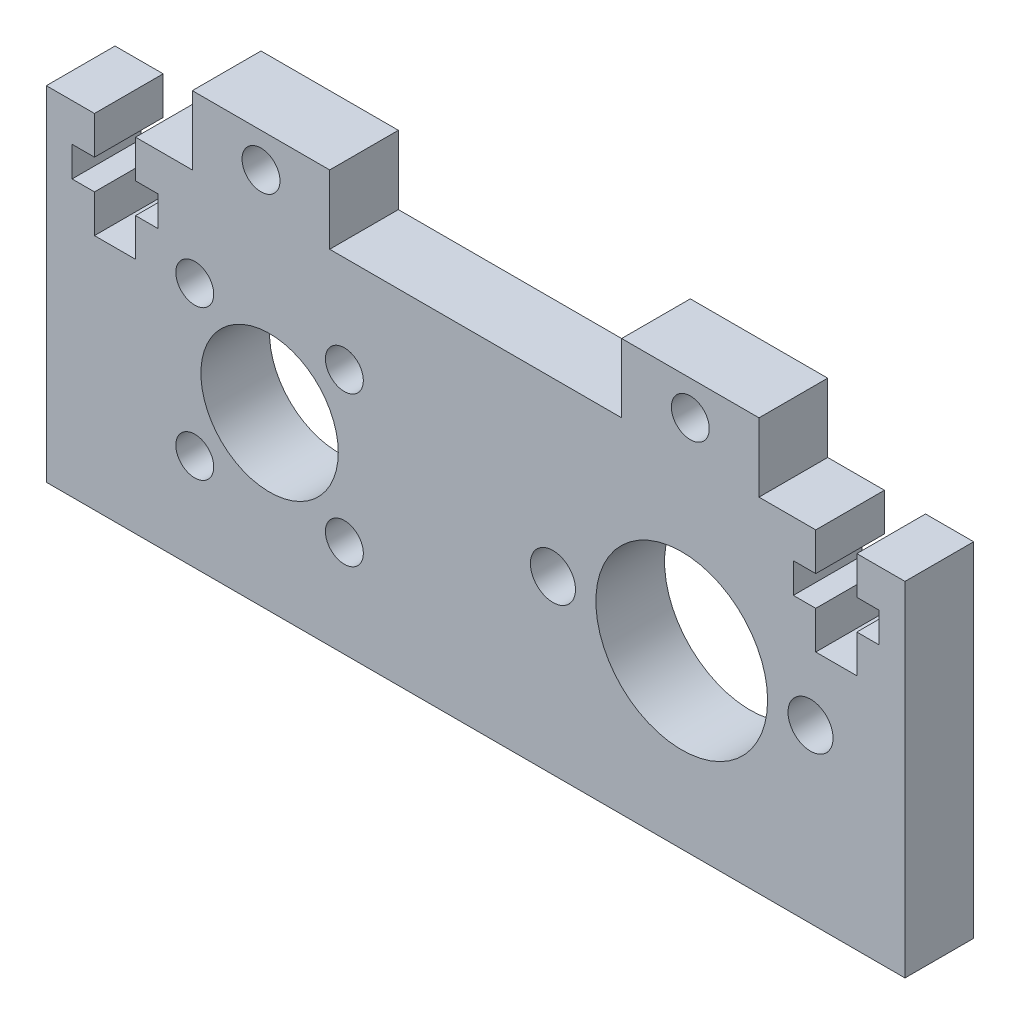
from build123d import *

# Parameters (mm, degrees)
SKETCH1_W           = 39.6875
SKETCH1_H           = 31.75
BOSS_EXTRUDE1_DEPTH = 6.35
SKETCH2_R           = 6.35
SKETCH2_R_2         = 1.7526
CUT_EXTRUDE1_DEPTH  = 6.35
CUT_EXTRUDE4_DEPTH  = 6.35
SKETCH4_W           = 12.7
SKETCH4_H           = 6.35
SKETCH4_R           = 1.7526
BOSS_EXTRUDE2_DEPTH = 6.35
SKETCH5_R           = 7.9375
SKETCH5_R_2         = 2.0828
CUT_EXTRUDE3_DEPTH  = 6.35


with BuildPart() as part:
    # Sketch1 → Boss-Extrude1 (new body)
    with BuildSketch(Plane.XY):
        with Locations((-19.84375, 0)):
            Rectangle(SKETCH1_W, SKETCH1_H)
    boss_extrude1 = extrude(amount=BOSS_EXTRUDE1_DEPTH)

    # Sketch2 → Cut-Extrude1 (cut)
    with BuildSketch(Plane.XY.offset(6.35)):
        with Locations((-19.05, 0)):
            Circle(SKETCH2_R)
        with Locations((-25.964797213, 6.914797213)):
            Circle(SKETCH2_R_2)
        with Locations((-12.135202787, 6.914797213)):
            Circle(SKETCH2_R_2)
        with Locations((-12.135202787, -6.914797213)):
            Circle(SKETCH2_R_2)
        with Locations((-25.964797213, -6.914797213)):
            Circle(SKETCH2_R_2)
    extrude(amount=-CUT_EXTRUDE1_DEPTH, mode=Mode.SUBTRACT)

    # Sketch3 → Cut-Extrude4 (cut)
    with BuildSketch(Plane.XY.offset(6.35)):
        Polygon((-35.23615, 6.096), (-31.43885, 6.096), (-31.43885, 9.5964375), (-29.36875, 9.5964375), (-29.36875, 12.3745625), (-31.43885, 12.3745625), (-31.43885, 15.875), (-35.23615, 15.875), (-35.23615, 12.3745625), (-37.30625, 12.3745625), (-37.30625, 9.5964375), (-35.23615, 9.5964375), align=None)
    cut_extrude4 = extrude(amount=-CUT_EXTRUDE4_DEPTH, mode=Mode.SUBTRACT)

    # Sketch4 → Boss-Extrude2 (add)
    with BuildSketch(Plane.XY.offset(6.35)):
        with Locations((-19.84375, 19.05)):
            Rectangle(SKETCH4_W, SKETCH4_H)
        with Locations((-19.84375, 19.05)):
            Circle(SKETCH4_R, mode=Mode.SUBTRACT)
    boss_extrude2 = extrude(amount=-BOSS_EXTRUDE2_DEPTH)

    # Mirror1: Boss-Extrude1, Cut-Extrude4, Boss-Extrude2 across plane
    add(boss_extrude1.mirror(Plane(origin=(0, -15.875, 6.35), x_dir=(0, 0, 1), z_dir=(-1, 0, 0))))
    add(cut_extrude4.mirror(Plane(origin=(0, -15.875, 6.35), x_dir=(0, 0, 1), z_dir=(-1, 0, 0))), mode=Mode.SUBTRACT)
    add(boss_extrude2.mirror(Plane(origin=(0, -15.875, 6.35), x_dir=(0, 0, 1), z_dir=(-1, 0, 0))))

    # Sketch5 → Cut-Extrude3 (cut)
    with BuildSketch(Plane.XY.offset(6.35)):
        with Locations((19.05, 0)):
            Circle(SKETCH5_R)
        with Locations((7.14375, 0)):
            Circle(SKETCH5_R_2)
        with Locations((30.95625, 0)):
            Circle(SKETCH5_R_2)
    extrude(amount=-CUT_EXTRUDE3_DEPTH, mode=Mode.SUBTRACT)


solid = part.part
